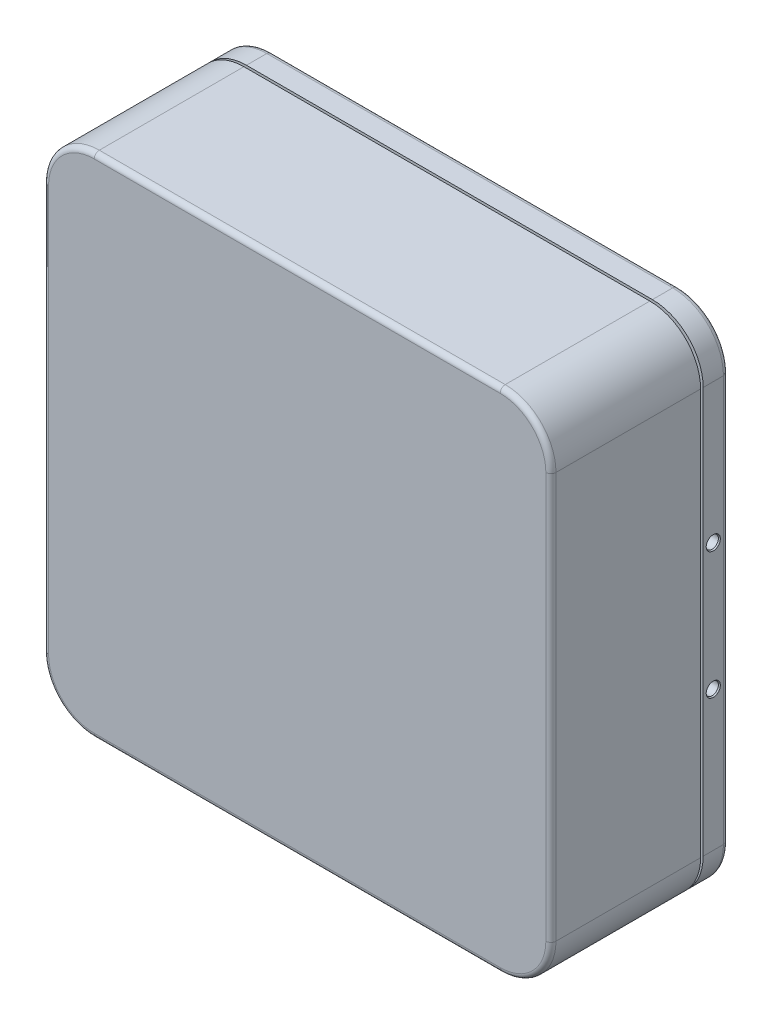
from build123d import *
from OCP.BRepFilletAPI import BRepFilletAPI_MakeChamfer

# Parameters (mm, degrees)
SKETCH1_W           = 200
SKETCH1_H           = 200
BOSS_EXTRUDE1_DEPTH = 70
FILLET1_R           = 20
FILLET2_R           = 2
SKETCH2_W           = 230.455547831
SKETCH2_H           = 230.807926345
CUT_EXTRUDE1_DEPTH  = 1
SKETCH3_R           = 2.5
CUT_EXTRUDE2_DEPTH  = 5
CHAMFER1_SIZE       = 0.5
CHAMFER1_SIZE2      = 0.288675135
CHAMFER2_SIZE       = 0.5
CHAMFER2_SIZE2      = 0.288675135


with BuildPart() as part:
    # Sketch1 → Boss-Extrude1 (new body)
    with BuildSketch(Plane.XY):
        with Locations((100, 100)):
            Rectangle(SKETCH1_W, SKETCH1_H)
    extrude(amount=BOSS_EXTRUDE1_DEPTH)

    # Fillet1
    fillet1_edges = [part.edges().sort_by_distance(p)[0] for p in [
        (0, 0, 35),
        (200, 0, 35),
        (200, 200, 35),
        (0, 200, 35),
    ]]
    fillet(fillet1_edges, radius=FILLET1_R)

    # Fillet2
    fillet2_edges = [part.edges().sort_by_distance(p)[0] for p in [
        (100, 200, 0),
        (100, 200, 70),
        (0, 100, 0),
        (200, 100, 0),
        (100, 0, 0),
        (5.857864376, 5.857864376, 0),
        (5.857864376, 194.142135624, 0),
        (194.142135624, 5.857864376, 0),
        (194.142135624, 194.142135624, 0),
        (200, 100, 70),
        (0, 100, 70),
        (100, 0, 70),
        (5.857864376, 5.857864376, 70),
        (5.857864376, 194.142135624, 70),
        (194.142135624, 5.857864376, 70),
        (194.142135624, 194.142135624, 70),
    ]]
    fillet(fillet2_edges, radius=FILLET2_R)

    # Sketch2 → Cut-Extrude1 (cut)
    with BuildSketch(Plane(origin=(0, 0, 10), x_dir=(-1, 0, 0), z_dir=(0, 0, -1))):
        with Locations((-100.412379168, 99.554731442)):
            Rectangle(SKETCH2_W, SKETCH2_H)
        with BuildLine():
            Line((-7, 20), (-7, 180))
            ThreePointArc((-7, 180), (-10.807611845, 189.192388155), (-20, 193))
            Line((-20, 193), (-180, 193))
            ThreePointArc((-180, 193), (-189.192388155, 189.192388155), (-193, 180))
            Line((-193, 180), (-193, 20))
            ThreePointArc((-193, 20), (-189.192388155, 10.807611845), (-180, 7))
            Line((-180, 7), (-20, 7))
            ThreePointArc((-20, 7), (-10.807611845, 10.807611845), (-7, 20))
        make_face(mode=Mode.SUBTRACT)
    extrude(amount=-CUT_EXTRUDE1_DEPTH, mode=Mode.SUBTRACT)

    # Sketch3 → Cut-Extrude2 (cut)
    with BuildSketch(Plane.ZY):
        with Locations((6, 125)):
            Circle(SKETCH3_R)
        with Locations((6, 75)):
            Circle(SKETCH3_R)
    cut_extrude2 = extrude(amount=-CUT_EXTRUDE2_DEPTH, mode=Mode.SUBTRACT)

    # Chamfer1
    chamfer1_edges = [part.edges().sort_by_distance(p)[0] for p in [
        (0, 125, 3.5),
        (0, 75, 3.5),
    ]]
    chamfer1_side = [part.faces().sort_by_distance(p)[0] for p in [
        (0, 100, 6),
    ]]
    chamfer(chamfer1_edges, length=CHAMFER1_SIZE, length2=CHAMFER1_SIZE2, reference=chamfer1_side[0])

    # Mirror2: Cut-Extrude2 across plane
    add(cut_extrude2.mirror(Plane.ZY.offset(-100)), mode=Mode.SUBTRACT)

    # Chamfer2: one chamfer whose edges measure the first distance from different faces: ONE call of the kernel's chamfer builder (chamfer() names one face for all edges)
    chamfer2_edges_1 = [part.edges().sort_by_distance(p)[0] for p in [
        (200, 125, 3.5),
    ]]
    chamfer2_side_1 = [part.faces().sort_by_distance(p)[0] for p in [
        (197.5, 125, 3.5),
    ]]
    chamfer2_edges_2 = [part.edges().sort_by_distance(p)[0] for p in [
        (200, 75, 3.5),
    ]]
    chamfer2_side_2 = [part.faces().sort_by_distance(p)[0] for p in [
        (197.5, 75, 3.5),
    ]]
    chamfer2 = BRepFilletAPI_MakeChamfer(part.part.solid().wrapped)
    for e in chamfer2_edges_1:
        chamfer2.Add(CHAMFER2_SIZE, CHAMFER2_SIZE2, e.wrapped, chamfer2_side_1[0].wrapped)  # the first distance lies on this face
    for e in chamfer2_edges_2:
        chamfer2.Add(CHAMFER2_SIZE, CHAMFER2_SIZE2, e.wrapped, chamfer2_side_2[0].wrapped)  # the first distance lies on this face
    add(Compound.cast(chamfer2.Shape()), mode=Mode.REPLACE)


solid = part.part
